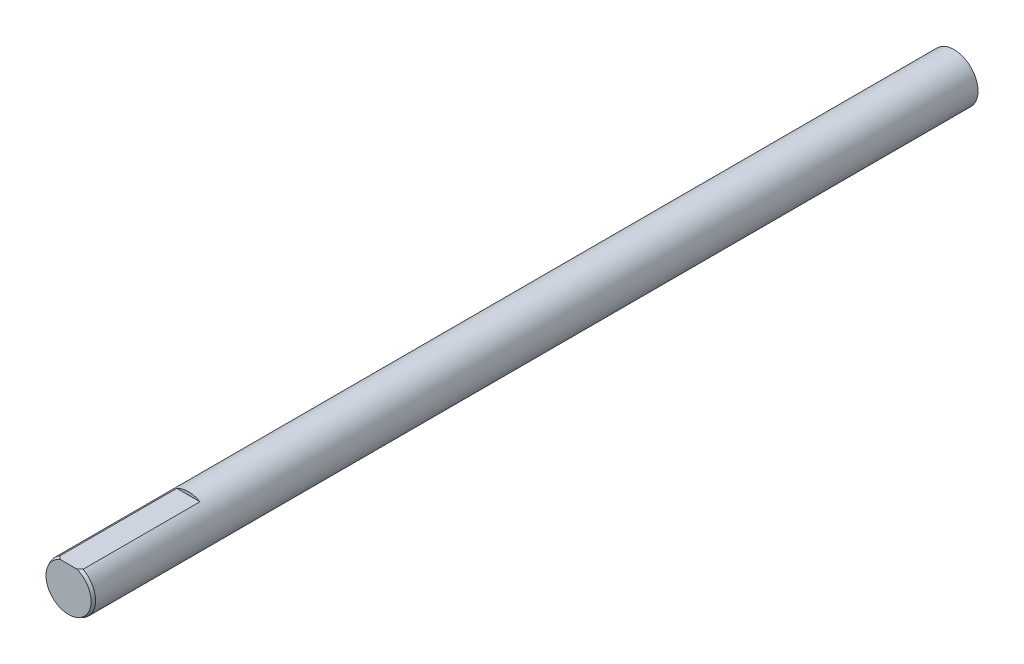
from build123d import *
from OCP.BRepFilletAPI import BRepFilletAPI_MakeChamfer

# Parameters (mm, degrees)
SKICA1_R                 = 4
P_IDAT_VYSUNUT_M1_DEPTH  = 148
ZKOSEN_1_SIZE            = 0.5
ZKOSEN_1_SIZE2           = 0.233153829
ODEBRAT_START            = -20
ODEBRAT_VYSUNUT_M1_DEPTH = 20


with BuildPart() as part:
    # Skica1 → Přidat vysunutím1 (new body)
    with BuildSketch(Plane.XY):
        Circle(SKICA1_R)
    extrude(amount=P_IDAT_VYSUNUT_M1_DEPTH)

    # Zkosení1: one chamfer whose edges measure the first distance from different faces: ONE call of the kernel's chamfer builder (chamfer() names one face for all edges)
    zkosen_1_edges_1 = [part.edges().sort_by_distance(p)[0] for p in [
        (-4, 0, 0),
    ]]
    zkosen_1_side_1 = [part.faces().sort_by_distance(p)[0] for p in [
        (0, 0, 0),
    ]]
    zkosen_1_edges_2 = [part.edges().sort_by_distance(p)[0] for p in [
        (-4, 0, 148),
    ]]
    zkosen_1_side_2 = [part.faces().sort_by_distance(p)[0] for p in [
        (-4, 0, 74),
    ]]
    zkosen_1 = BRepFilletAPI_MakeChamfer(part.part.solid().wrapped)
    for e in zkosen_1_edges_1:
        zkosen_1.Add(ZKOSEN_1_SIZE, ZKOSEN_1_SIZE2, e.wrapped, zkosen_1_side_1[0].wrapped)  # the first distance lies on this face
    for e in zkosen_1_edges_2:
        zkosen_1.Add(ZKOSEN_1_SIZE, ZKOSEN_1_SIZE2, e.wrapped, zkosen_1_side_2[0].wrapped)  # the first distance lies on this face
    add(Compound.cast(zkosen_1.Shape()), mode=Mode.REPLACE)

    # Skica2 → Odebrat vysunutím1 (cut)
    with BuildSketch(Plane.XY.offset(148).offset(ODEBRAT_START)):
        with BuildLine():
            Line((-1.936491673, 3.5), (1.936491673, 3.5))
            ThreePointArc((1.936491673, 3.5), (0, 4), (-1.936491673, 3.5))
        make_face()
    extrude(amount=ODEBRAT_VYSUNUT_M1_DEPTH, mode=Mode.SUBTRACT)


solid = part.part
